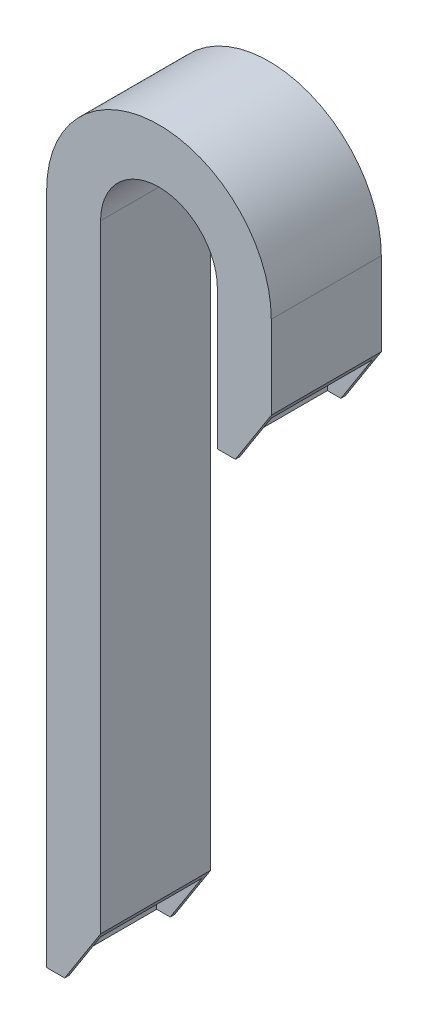
from build123d import *

# Parameters (mm, degrees)
EXTRUDE_1_DEPTH        = 24.5
SHELL_1_T              = -2
CUT_EXTRUDE_1_DEPTH    = 365.204612821
HOLE_WIZARD_M4_1_D     = 4.5
HOLE_WIZARD_M4_2_D     = 4.5
HOLE_WIZARD_M4_2_DEPTH = 2


with BuildPart() as part:
    # 草图1 → 拉伸-薄壁1 (new, symmetric)
    with BuildSketch(Plane.XY):
        with BuildLine():
            Line((12, 0), (12, 300))
            ThreePointArc((12, 300), (38, 326), (64, 300))
            Line((64, 300), (64, 238))
            Line((64, 238), (88, 238))
            Line((88, 238), (88, 300))
            ThreePointArc((88, 300), (38, 350), (-12, 300))
            Line((-12, 300), (-12, 0))
            Line((-12, 0), (12, 0))
        make_face()
    extrude(amount=EXTRUDE_1_DEPTH, both=True)

    # 抽壳1
    shell_1_openings = [part.faces().sort_by_distance(p)[0] for p in [
        (0, 0, 0),
        (76, 238, 0),
    ]]
    offset(amount=SHELL_1_T, openings=shell_1_openings, kind=Kind.INTERSECTION)

    # 草图2 → 切除-拉伸1 (cut, through all)
    with BuildSketch(Plane.XY.offset(24.5)):
        Polygon((88, 263), (88, 238), (72, 238), align=None)
        Polygon((12, 25), (12, 0), (-4, 0), align=None)
    extrude(amount=-CUT_EXTRUDE_1_DEPTH, mode=Mode.SUBTRACT)

    # M4 间隙孔1 (through all)
    with Locations(Plane(origin=(-10, 0, 0), x_dir=(0, 0, -1), z_dir=(1, 0, 0))):
        with Locations((12.5, 10), (-12.5, 10)):
            Hole(HOLE_WIZARD_M4_1_D / 2)

    # M4 间隙孔2
    with Locations(Plane(origin=(66, 0, 0), x_dir=(0, 0, -1), z_dir=(1, 0, 0))):
        with Locations((12.5, 248), (-12.5, 248)):
            Hole(HOLE_WIZARD_M4_2_D / 2, depth=HOLE_WIZARD_M4_2_DEPTH)


solid = part.part
